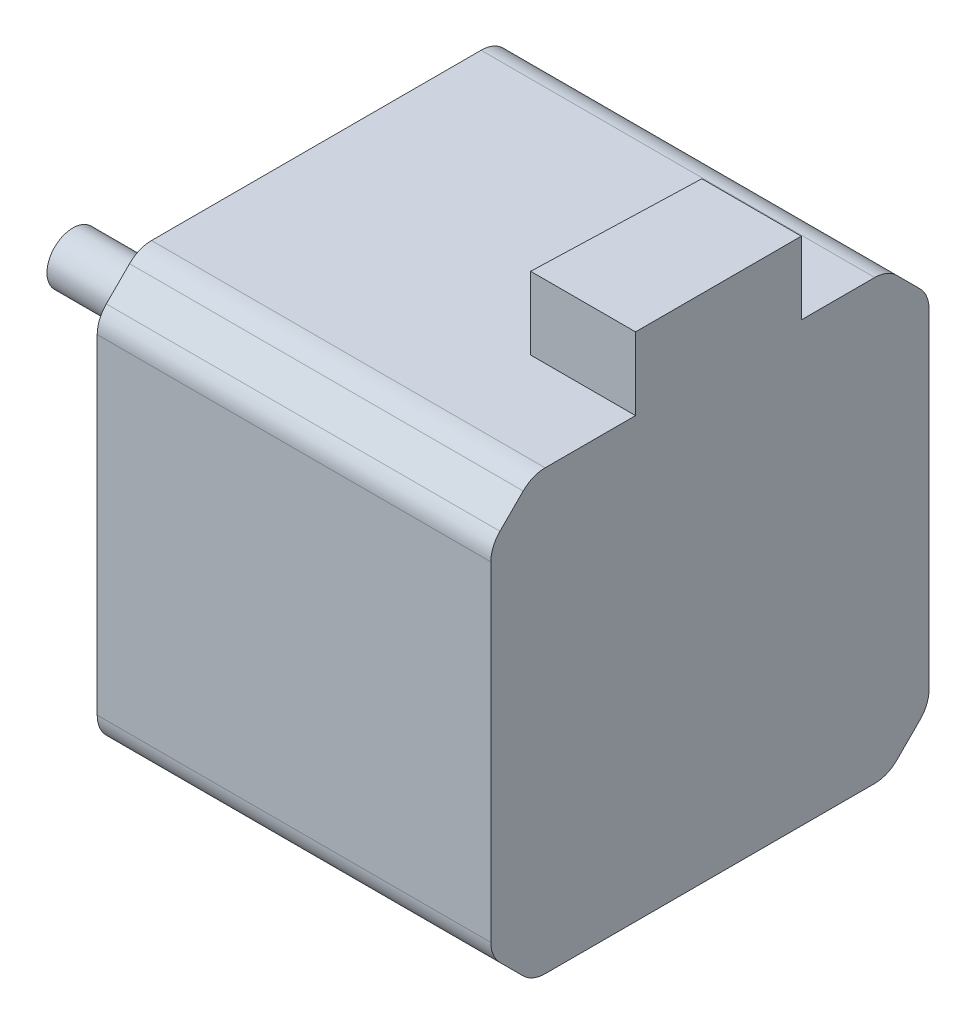
from build123d import *

# Parameters (mm, degrees)
EXTRUDE_2_DEPTH          = 38
SKETCH_2_R               = 11
EXTRUDE_3_DEPTH          = 2
FILLET_1_R               = 1
SKETCH_3_R               = 2.5
EXTRUDE_4_DEPTH          = 21.5
SKETCH_4_R               = 1.5
CUT_EXTRUDE_1_DEPTH      = 4.5
PATTERN_CIRCULAR_1_COUNT = 4
EXTRUDE_5_DEPTH          = 7


with BuildPart() as part:
    # 草图1 → 凸台-拉伸2 (new body)
    with BuildSketch(Plane(origin=(0, 0, 0), x_dir=(0, 0, -1), z_dir=(1, 0, 0))):
        with BuildLine():
            Line((0.878679656, 39.178679656), (3.121320344, 41.421320344))
            ThreePointArc((3.121320344, 41.421320344), (4.09459039, 42.071638598), (5.242640687, 42.3))
            Line((5.242640687, 42.3), (37.057359313, 42.3))
            ThreePointArc((37.057359313, 42.3), (38.20540961, 42.071638598), (39.178679656, 41.421320344))
            Line((39.178679656, 41.421320344), (41.421320344, 39.178679656))
            ThreePointArc((41.421320344, 39.178679656), (42.071638598, 38.20540961), (42.3, 37.057359313))
            Line((42.3, 37.057359313), (42.3, 5.242640687))
            ThreePointArc((42.3, 5.242640687), (42.071638598, 4.09459039), (41.421320344, 3.121320344))
            Line((41.421320344, 3.121320344), (39.178679656, 0.878679656))
            ThreePointArc((39.178679656, 0.878679656), (38.20540961, 0.228361402), (37.057359313, 0))
            Line((37.057359313, 0), (5.242640687, 0))
            ThreePointArc((5.242640687, 0), (4.09459039, 0.228361402), (3.121320344, 0.878679656))
            Line((3.121320344, 0.878679656), (0.878679656, 3.121320344))
            ThreePointArc((0.878679656, 3.121320344), (0.228361402, 4.09459039), (0, 5.242640687))
            Line((0, 5.242640687), (0, 37.057359313))
            ThreePointArc((0, 37.057359313), (0.228361402, 38.20540961), (0.878679656, 39.178679656))
        make_face()
    extrude(amount=EXTRUDE_2_DEPTH)

    # 草图2 → 凸台-拉伸3 (add)
    with BuildSketch(Plane.ZY):
        with Locations((-21.15, 21.15)):
            Circle(SKETCH_2_R)
    extrude(amount=EXTRUDE_3_DEPTH)

    # 圆角1
    fillet_1_edges = [part.edges().sort_by_distance(p)[0] for p in [
        (-2, 21.15, -32.15),
    ]]
    fillet(fillet_1_edges, radius=FILLET_1_R)

    # 草图3 → 凸台-拉伸4 (add)
    with BuildSketch(Plane.ZY.offset(2)):
        with Locations((-21.15, 21.15)):
            Circle(SKETCH_3_R)
    extrude(amount=EXTRUDE_4_DEPTH)

    # 草图4 → 切除-拉伸1 (cut)
    with BuildSketch(Plane.ZY):
        with Locations((-36.65, 36.65)):
            Circle(SKETCH_4_R)
    cut_extrude_1 = extrude(amount=-CUT_EXTRUDE_1_DEPTH, mode=Mode.SUBTRACT)

    # 阵列(圆周)1: 切除-拉伸1 ×4 about axis
    pattern_circular_1_axis = Axis((0, 21.15, -21.15), (1, 0, 0))
    for i in range(1, PATTERN_CIRCULAR_1_COUNT):
        add(cut_extrude_1.rotate(pattern_circular_1_axis, i * 360 / PATTERN_CIRCULAR_1_COUNT), mode=Mode.SUBTRACT)

    # 草图6 → 凸台-拉伸5 (add)
    with BuildSketch(Plane(origin=(0, 42.3, 0), x_dir=(1, 0, 0), z_dir=(0, 1, 0))):
        Polygon((28.4, 29.967521896), (38, 29.967521896), (38, 13.967521896), (27.87263434, 13.967521896), align=None)
    extrude(amount=EXTRUDE_5_DEPTH)


solid = part.part
